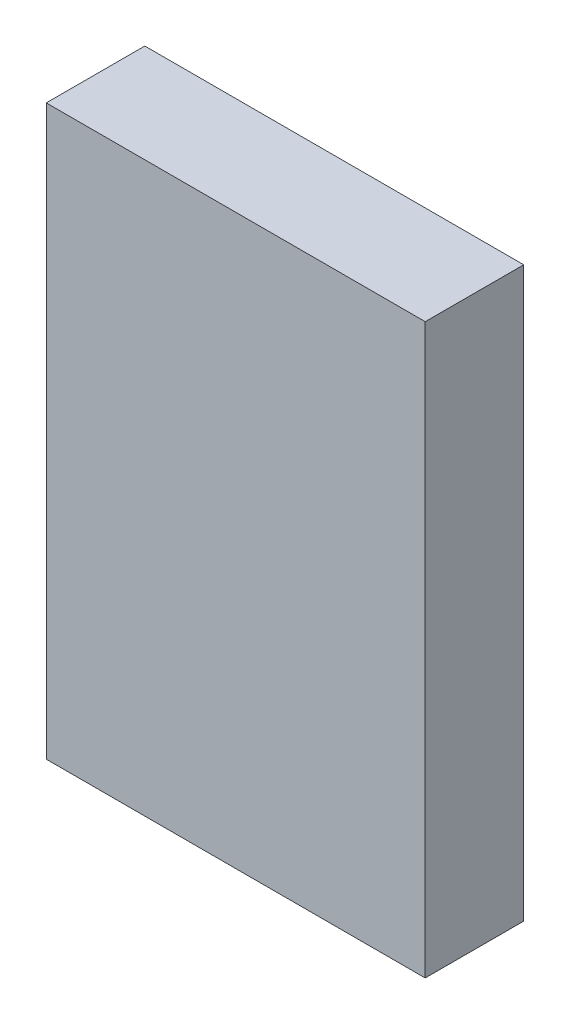
from build123d import *

# Parameters (mm, degrees)
SKETCH1_W           = 10
SKETCH1_H           = 15
BOSS_EXTRUDE1_DEPTH = 2.6


with BuildPart() as part:
    # Sketch1 → Boss-Extrude1 (new body)
    with BuildSketch(Plane.XY):
        Rectangle(SKETCH1_W, SKETCH1_H)
    extrude(amount=BOSS_EXTRUDE1_DEPTH)


solid = part.part
